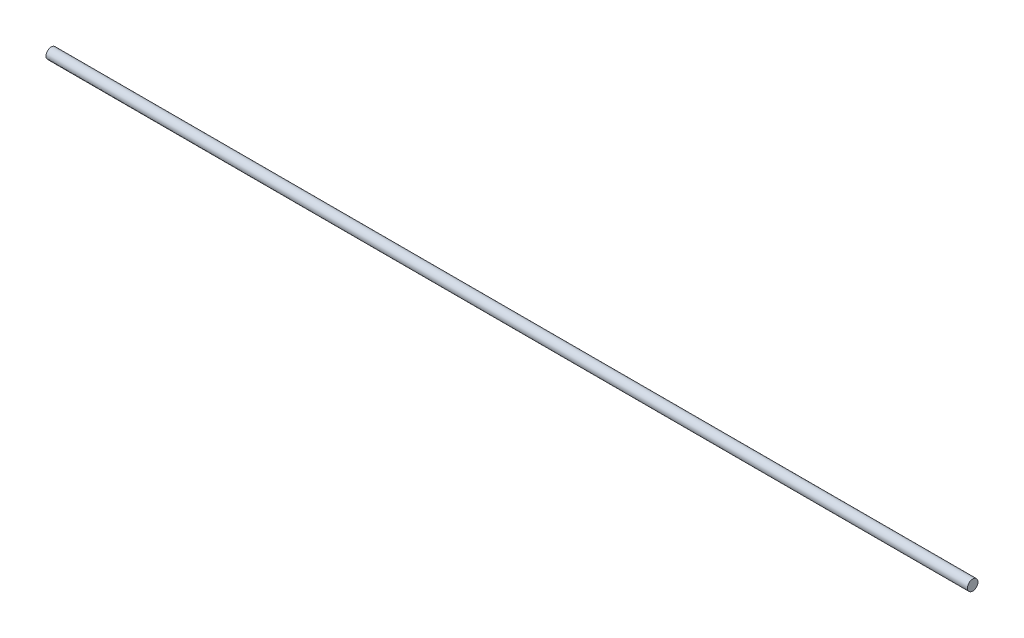
from build123d import *

# Parameters (mm, degrees)
CROQUIS1_R              = 4
SALIENTE_EXTRUIR1_DEPTH = 700


with BuildPart() as part:
    # Croquis1 → Saliente-Extruir1 (new body)
    with BuildSketch(Plane(origin=(0, 0, 0), x_dir=(0, 0, -1), z_dir=(1, 0, 0))):
        Circle(CROQUIS1_R)
    extrude(amount=SALIENTE_EXTRUIR1_DEPTH)


solid = part.part
